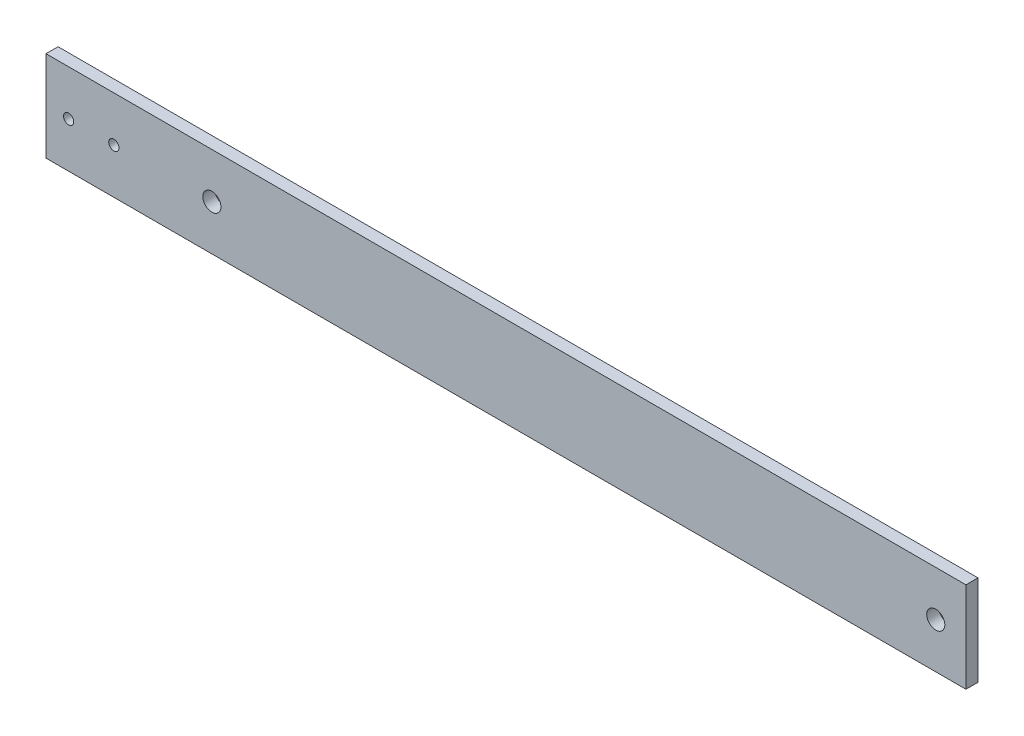
from build123d import *

# Parameters (mm, degrees)
SKETCH_1_W             = 610
SKETCH_1_H             = 60
EXTRUDE_1_DEPTH        = 8
MM_1_D                 = 12
PATTERN_LINEAR_1_COUNT = 2
PATTERN_LINEAR_1_PITCH = 480
MM_2_D                 = 6.8
PATTERN_LINEAR_2_COUNT = 2
PATTERN_LINEAR_2_PITCH = 30


with BuildPart() as part:
    # 草图1 → 凸台-拉伸1 (new body)
    with BuildSketch(Plane.XY):
        Rectangle(SKETCH_1_W, SKETCH_1_H)
    extrude(amount=EXTRUDE_1_DEPTH)

    # 大小mm 暗销孔1 (through all)
    with Locations(Plane(origin=(285, 0, 8), x_dir=(1, 0, 0), z_dir=(0, 0, 1))):
        with Locations((0, 0)):
            mm_1 = Hole(MM_1_D / 2)

    # 阵列(线性)1: 大小mm 暗销孔1 ×2
    with Locations(*[(-i * PATTERN_LINEAR_1_PITCH, 0, 0) for i in range(1, PATTERN_LINEAR_1_COUNT)]):
        add(mm_1, mode=Mode.SUBTRACT)

    # 大小mm 暗销孔2 (through all)
    with Locations(Plane(origin=(-290, 0, 8), x_dir=(1, 0, 0), z_dir=(0, 0, 1))):
        with Locations((0, 0)):
            mm_2 = Hole(MM_2_D / 2)

    # 阵列(线性)2: 大小mm 暗销孔2 ×2
    with Locations(*[(i * PATTERN_LINEAR_2_PITCH, 0, 0) for i in range(1, PATTERN_LINEAR_2_COUNT)]):
        add(mm_2, mode=Mode.SUBTRACT)


solid = part.part
